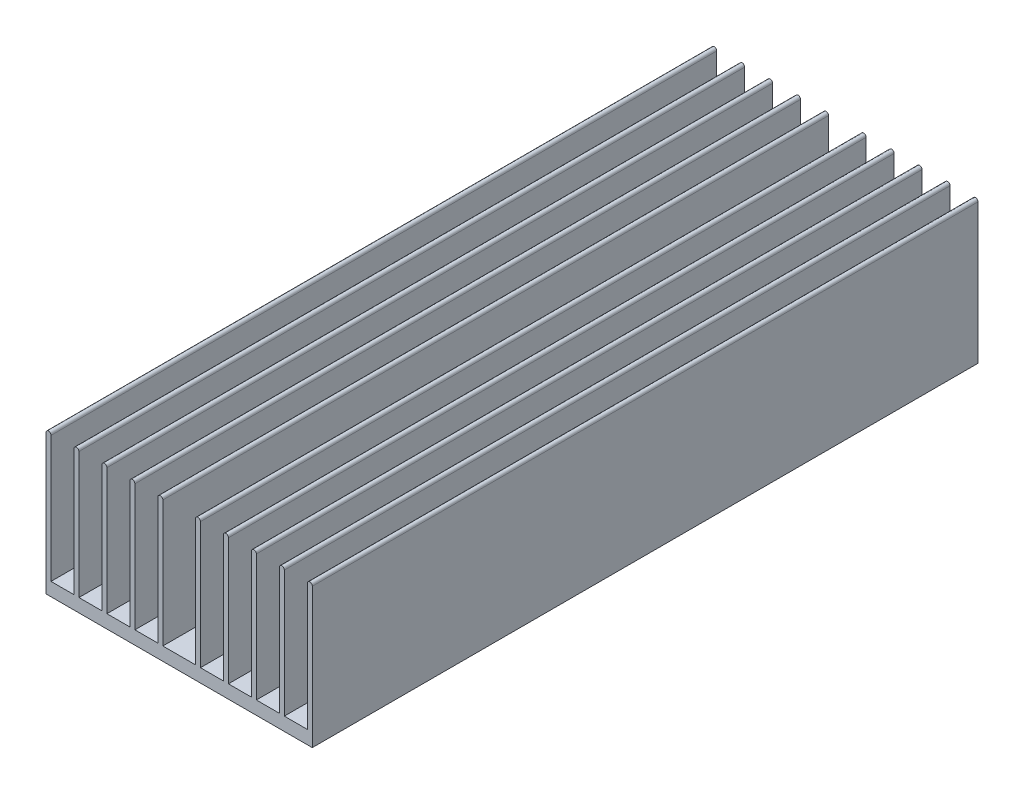
from build123d import *

# Parameters (mm, degrees)
SALIENTE_EXTRUIR1_DEPTH = 200
MATRIZL1_COUNT          = 5
MATRIZL1_PITCH          = 8.4
SIMETR_A1_COPY_1_DEPTH  = 200
SIMETR_A1_COPY_2_DEPTH  = 200
SIMETR_A1_COPY_3_DEPTH  = 200
SIMETR_A1_COPY_4_DEPTH  = 200


with BuildPart() as part:
    # Croquis1 → Saliente-Extruir1 (new body)
    with BuildSketch(Plane.XY):
        with BuildLine():
            Line((31.6, 4), (31.6, 0))
            Line((31.6, 0), (40, 0))
            Line((40, 0), (40, 42))
            ThreePointArc((40, 42), (39.25, 42.75), (38.5, 42))
            Line((38.5, 42), (38.5, 4))
            Line((38.5, 4), (31.6, 4))
        make_face()
    saliente_extruir1 = extrude(amount=SALIENTE_EXTRUIR1_DEPTH)

    # MatrizL1: Saliente-Extruir1 ×5
    with Locations(*[(-i * MATRIZL1_PITCH, 0, 0) for i in range(1, MATRIZL1_COUNT)]):
        add(saliente_extruir1)



with BuildPart() as simetr_a1_1:
    # Simetría1: Saliente-Extruir1 across plane
    add(saliente_extruir1.mirror(Plane(origin=(0, 0, 0), x_dir=(0, 0, 1), z_dir=(1, 0, 0))))

    # Simetría1 copy 1 sketch → Simetría1 copy 1 (add)
    with BuildSketch(Plane(origin=(8.4, 0, 0), x_dir=(-1, 0, 0), z_dir=(0, 0, 1))):
        with BuildLine():
            Line((31.6, -4), (31.6, 0))
            Line((31.6, 0), (40, 0))
            Line((40, 0), (40, -42))
            ThreePointArc((40, -42), (39.25, -42.75), (38.5, -42))
            Line((38.5, -42), (38.5, -4))
            Line((38.5, -4), (31.6, -4))
        make_face()
    extrude(amount=SIMETR_A1_COPY_1_DEPTH)

    # Simetría1 copy 2 sketch → Simetría1 copy 2 (add)
    with BuildSketch(Plane(origin=(16.8, 0, 0), x_dir=(-1, 0, 0), z_dir=(0, 0, 1))):
        with BuildLine():
            Line((31.6, -4), (31.6, 0))
            Line((31.6, 0), (40, 0))
            Line((40, 0), (40, -42))
            ThreePointArc((40, -42), (39.25, -42.75), (38.5, -42))
            Line((38.5, -42), (38.5, -4))
            Line((38.5, -4), (31.6, -4))
        make_face()
    extrude(amount=SIMETR_A1_COPY_2_DEPTH)

    # Simetría1 copy 3 sketch → Simetría1 copy 3 (add)
    with BuildSketch(Plane(origin=(25.2, 0, 0), x_dir=(-1, 0, 0), z_dir=(0, 0, 1))):
        with BuildLine():
            Line((31.6, -4), (31.6, 0))
            Line((31.6, 0), (40, 0))
            Line((40, 0), (40, -42))
            ThreePointArc((40, -42), (39.25, -42.75), (38.5, -42))
            Line((38.5, -42), (38.5, -4))
            Line((38.5, -4), (31.6, -4))
        make_face()
    extrude(amount=SIMETR_A1_COPY_3_DEPTH)


with BuildPart() as part_1:
    add(part.part)

    add(simetr_a1_1.part)  # Simetría1 copy 4 merges Simetría1_1
    # Simetría1 copy 4 sketch → Simetría1 copy 4 (add)
    with BuildSketch(Plane(origin=(33.6, 0, 0), x_dir=(-1, 0, 0), z_dir=(0, 0, 1))):
        with BuildLine():
            Line((31.6, -4), (31.6, 0))
            Line((31.6, 0), (40, 0))
            Line((40, 0), (40, -42))
            ThreePointArc((40, -42), (39.25, -42.75), (38.5, -42))
            Line((38.5, -42), (38.5, -4))
            Line((38.5, -4), (31.6, -4))
        make_face()
    extrude(amount=SIMETR_A1_COPY_4_DEPTH)


solid = part_1.part
